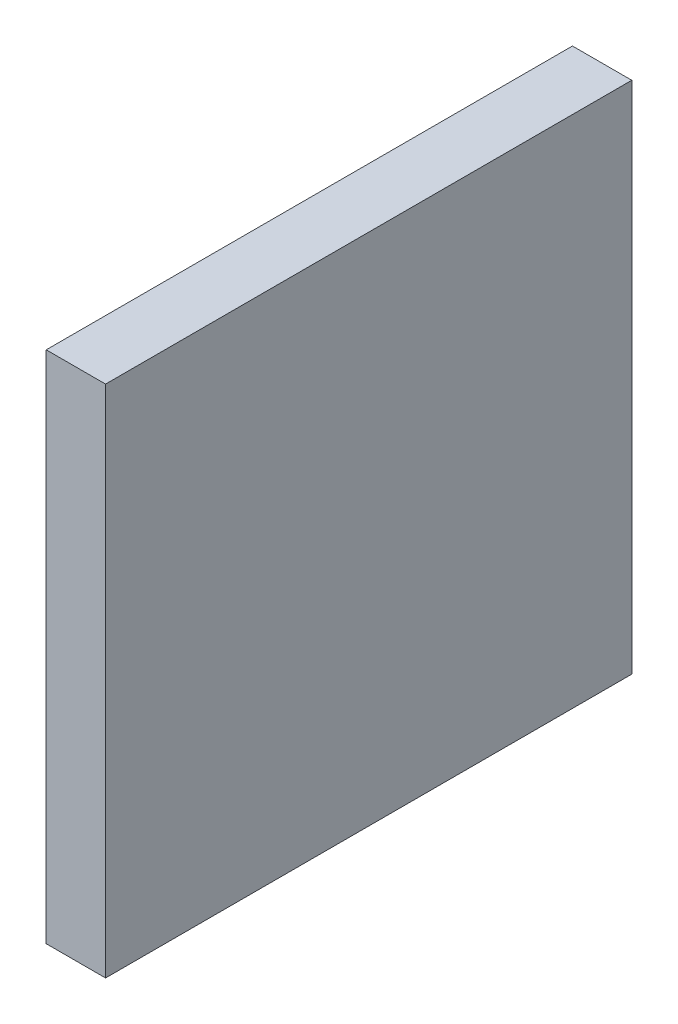
from build123d import *

# Parameters (mm, degrees)
SKETCH1_W           = 168.91
SKETCH1_H           = 165.1
BOSS_EXTRUDE1_DEPTH = 19.05


with BuildPart() as part:
    # Sketch1 → Boss-Extrude1 (new body)
    with BuildSketch(Plane(origin=(0, 0, 0), x_dir=(0, 0, -1), z_dir=(1, 0, 0))):
        with Locations((47.553396255, -34.904891368)):
            Rectangle(SKETCH1_W, SKETCH1_H)
    extrude(amount=BOSS_EXTRUDE1_DEPTH)


solid = part.part
